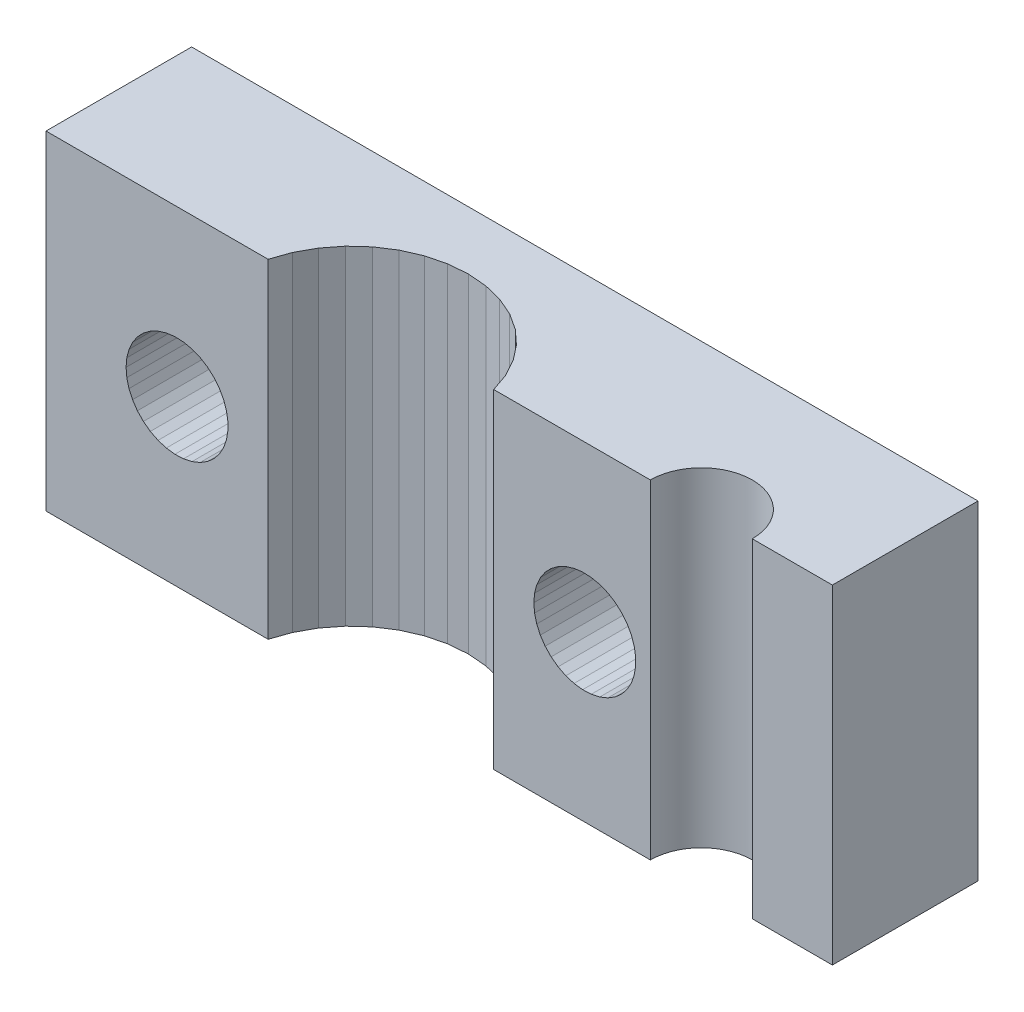
from build123d import *

# Parameters (mm, degrees)
ESQUISSE1_W             = 27
ESQUISSE1_H             = 11.300000191
BOSS_EXTRU_1_DEPTH      = 5
ENL_V_MAT_EXTRU_1_DEPTH = 30.693265302
ENL_V_MAT_EXTRU_2_DEPTH = 30.693265302
ENL_V_MAT_EXTRU_3_DEPTH = 30.693265302
ENL_V_MAT_EXTRU_4_DEPTH = 30.693265302
D_POUILLE1_ANGLE        = 19.197649098
D_POUILLE2_ANGLE        = 19.197649098


with BuildPart() as part:
    # Esquisse1 → Boss.-Extru.1 (new body)
    with BuildSketch(Plane(origin=(0, 0, 0), x_dir=(-1, 0, 0), z_dir=(0, 0, -1))):
        with Locations((-13.5, 5.650000096)):
            Rectangle(ESQUISSE1_W, ESQUISSE1_H)
    extrude(amount=-BOSS_EXTRU_1_DEPTH)

    # Esquisse2 → Enlèv. mat.-Extru.1 (cut, through all)
    with BuildSketch(Plane(origin=(0, 11.300000191, 0), x_dir=(-1, 0, 0), z_dir=(0, 1, 0))):
        Polygon((-15.372982979, 5), (-15.372982979, 4.774707955), (-14.840999603, 3.800517559), (-14.434993744, 3.282314301), (-13.949490547, 2.83772254), (-13.397639275, 2.478783607), (-12.794389725, 2.21522069), (-12.156080246, 2.054171801), (-11.5, 2), (-10.843919754, 2.054171801), (-10.205610275, 2.21522069), (-9.602360725, 2.478783607), (-9.050509453, 2.83772254), (-8.56500721, 3.282314301), (-8.159000397, 3.800517559), (-7.627017021, 4.774707955), (-7.627017021, 5), align=None)
    extrude(amount=-ENL_V_MAT_EXTRU_1_DEPTH, mode=Mode.SUBTRACT)

    # Esquisse3 → Enlèv. mat.-Extru.2 (cut, through all)
    with BuildSketch(Plane(origin=(0, 11.300000191, 0), x_dir=(-1, 0, 0), z_dir=(0, 1, 0))):
        with BuildLine():
            Line((-20.75, 5), (-24.25, 5))
            ThreePointArc((-24.25, 5), (-22.5, 3.25), (-20.75, 5))
        make_face()
    extrude(amount=-ENL_V_MAT_EXTRU_2_DEPTH, mode=Mode.SUBTRACT)

    # Esquisse4 → Enlèv. mat.-Extru.3 (cut, through all)
    with BuildSketch(Plane(origin=(0, 0, 0), x_dir=(-1, 0, 0), z_dir=(0, 0, -1))):
        Polygon((-2.75, 5.650000095), (-2.775172234, 5.945751667), (-2.84996438, 6.232994556), (-2.972225189, 6.503466129), (-3.13843751, 6.74938488), (-3.343819141, 6.963676453), (-3.582462311, 7.140175819), (-3.847501278, 7.273805618), (-4.13131094, 7.360721588), (-4.425727844, 7.398423195), (-4.722281456, 7.385825634), (-5.012440205, 7.323291779), (-5.287856102, 7.212620258), (-5.540607929, 7.056994915), (-5.763422966, 6.86089325), (-5.949892044, 6.629955769), (-6.094649792, 6.370827198), (-6.193532467, 6.090961456), (-6.243695736, 5.798409939), (-6.25, 5.650000095), (-6.243695736, 5.501589775), (-6.193532467, 5.209038734), (-6.094649792, 4.929172993), (-5.949892044, 4.670043945), (-5.763422966, 4.439106941), (-5.540607929, 4.243005276), (-5.287856102, 4.087379456), (-5.012440205, 3.976708174), (-4.722281456, 3.91417408), (-4.425727844, 3.901576757), (-4.13131094, 3.939278364), (-3.847501278, 4.026194096), (-3.582462311, 4.159823895), (-3.343819141, 4.336323738), (-3.13843751, 4.550614834), (-2.972225189, 4.796534061), (-2.84996438, 5.067005157), (-2.775172234, 5.354248524), align=None)
    extrude(amount=-ENL_V_MAT_EXTRU_3_DEPTH, mode=Mode.SUBTRACT)

    # Esquisse5 → Enlèv. mat.-Extru.4 (cut, through all)
    with BuildSketch(Plane.XY.offset(5)):
        Polygon((16.77517128, 5.354248524), (16.849964142, 5.067005157), (16.972225189, 4.796534061), (17.138439178, 4.550614834), (17.343818665, 4.336323738), (17.582462311, 4.159823895), (17.847499847, 4.026194096), (18.131311417, 3.939278364), (18.425727844, 3.901576757), (18.722280502, 3.91417408), (19.012439728, 3.976708174), (19.287857056, 4.087379456), (19.540607452, 4.243005276), (19.76342392, 4.439106941), (19.949892044, 4.670043945), (20.094650269, 4.929172993), (20.193532944, 5.209038734), (20.243694305, 5.501589775), (20.243694305, 5.798409939), (20.193532944, 6.090961456), (20.094650269, 6.370827198), (19.949892044, 6.629955769), (19.76342392, 6.86089325), (19.540607452, 7.056994915), (19.287857056, 7.212620258), (19.012439728, 7.323291779), (18.722280502, 7.385825634), (18.425727844, 7.398423195), (18.131311417, 7.360721588), (17.847499847, 7.273805618), (17.582462311, 7.140175819), (17.343818665, 6.963676453), (17.138439178, 6.74938488), (16.972225189, 6.503466129), (16.849964142, 6.232994556), (16.77517128, 5.945751667), (16.75, 5.650000095), align=None)
    extrude(amount=-ENL_V_MAT_EXTRU_4_DEPTH, mode=Mode.SUBTRACT)

    # Dépouille1
    d_pouille1_faces = [part.faces().sort_by_distance(p)[0] for p in [
        (7.627017021, 5.650000095, 4.887353977),
    ]]
    draft(d_pouille1_faces, Plane.XY.offset(5), D_POUILLE1_ANGLE)

    # Dépouille2
    d_pouille2_faces = [part.faces().sort_by_distance(p)[0] for p in [
        (15.372982979, 5.650000095, 4.887353977),
    ]]
    draft(d_pouille2_faces, Plane.XY.offset(5), D_POUILLE2_ANGLE)


solid = part.part
